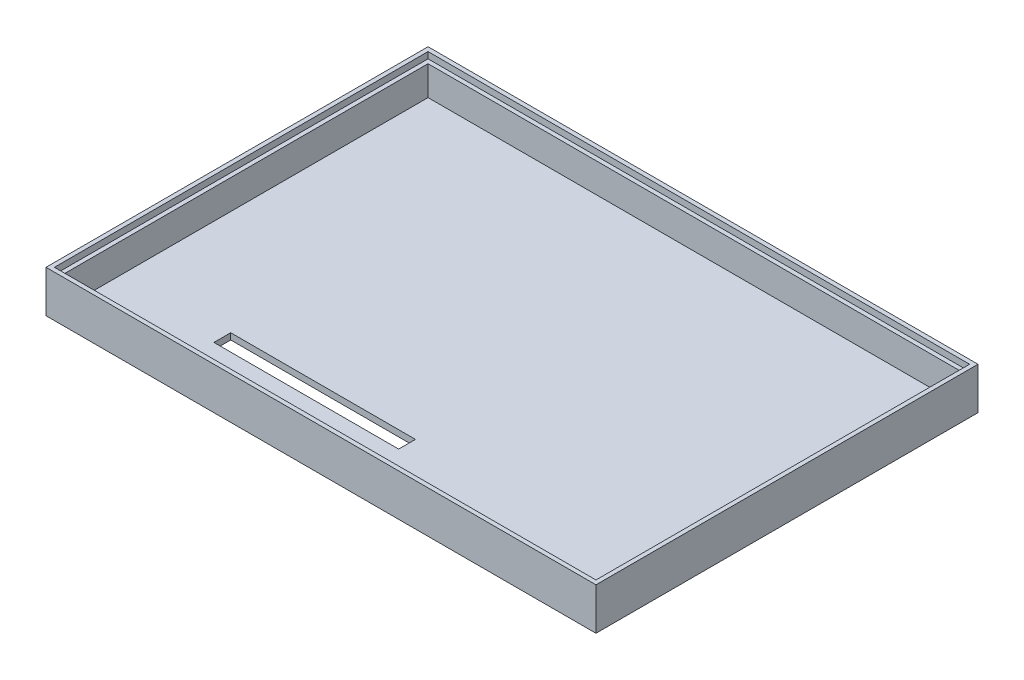
from build123d import *

# Parameters (mm, degrees)
SKETCH1_W           = 127
SKETCH1_H           = 87
BOSS_EXTRUDE1_DEPTH = 1.5
SKETCH2_W           = 131
SKETCH2_H           = 91
SKETCH2_W_2         = 127
SKETCH2_H_2         = 87
BOSS_EXTRUDE2_DEPTH = 10
CUT_EXTRUDE1_REACH  = 82.377
SKETCH3_W           = 44
SKETCH3_H           = 4
SKETCH5_W           = 129
SKETCH5_H           = 89
SKETCH5_W_2         = 127
SKETCH5_H_2         = 87
CUT_EXTRUDE3_DEPTH  = 1.5


with BuildPart() as part:
    # Sketch1 → Boss-Extrude1 (new body)
    with BuildSketch(Plane(origin=(0, 0, 0), x_dir=(1, 0, 0), z_dir=(0, 1, 0))):
        Rectangle(SKETCH1_W, SKETCH1_H)
    extrude(amount=BOSS_EXTRUDE1_DEPTH)

    # Sketch2 → Boss-Extrude2 (add)
    with BuildSketch(Plane(origin=(0, 0, 0), x_dir=(1, 0, 0), z_dir=(0, 1, 0))):
        Rectangle(SKETCH2_W, SKETCH2_H)
        Rectangle(SKETCH2_W_2, SKETCH2_H_2, mode=Mode.SUBTRACT)
    extrude(amount=BOSS_EXTRUDE2_DEPTH)

    # Sketch3 → Cut-Extrude1 (cut, up to next)
    with BuildSketch(Plane.XZ, mode=Mode.PRIVATE) as cut_extrude1_sk1:
        with Locations((-16.5, 30.5)):
            Rectangle(SKETCH3_W, SKETCH3_H)
    cut_extrude1_tool1 = extrude(cut_extrude1_sk1.sketch, amount=-CUT_EXTRUDE1_REACH, mode=Mode.PRIVATE) & part.part
    add(cut_extrude1_tool1.solids().sort_by_distance((-16.5, 0, 30.5))[0], mode=Mode.SUBTRACT)

    # Sketch5 → Cut-Extrude3 (cut)
    with BuildSketch(Plane(origin=(0, 10, 0), x_dir=(1, 0, 0), z_dir=(0, 1, 0))):
        Rectangle(SKETCH5_W, SKETCH5_H)
        Rectangle(SKETCH5_W_2, SKETCH5_H_2, mode=Mode.SUBTRACT)
    extrude(amount=-CUT_EXTRUDE3_DEPTH, mode=Mode.SUBTRACT)


solid = part.part
